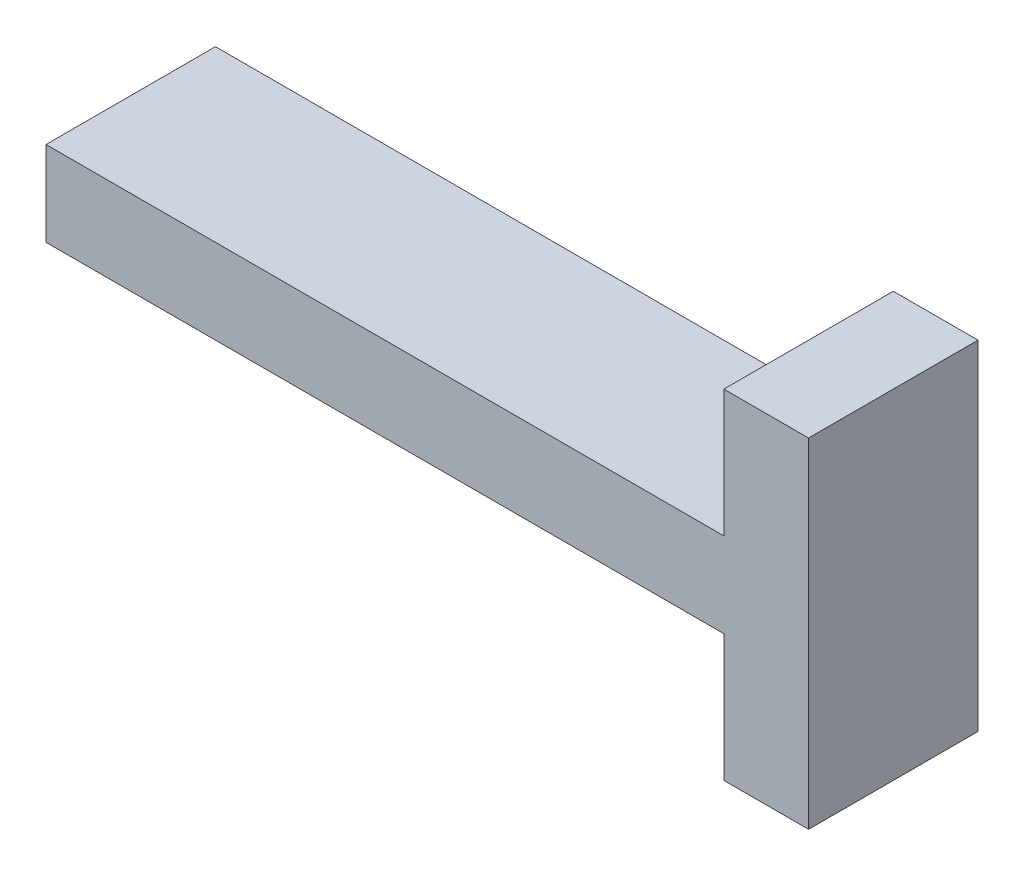
from build123d import *

# Parameters (mm, degrees)
BOSS_EXTRUDE1_DEPTH = 20


with BuildPart() as part:
    # Sketch1 → Boss-Extrude1 (new body)
    with BuildSketch(Plane.XY):
        Polygon((0, 0), (0, 15), (10, 15), (10, -25), (0, -25), (0, -10), (-80, -10), (-80, 0), align=None)
    extrude(amount=BOSS_EXTRUDE1_DEPTH)


solid = part.part
